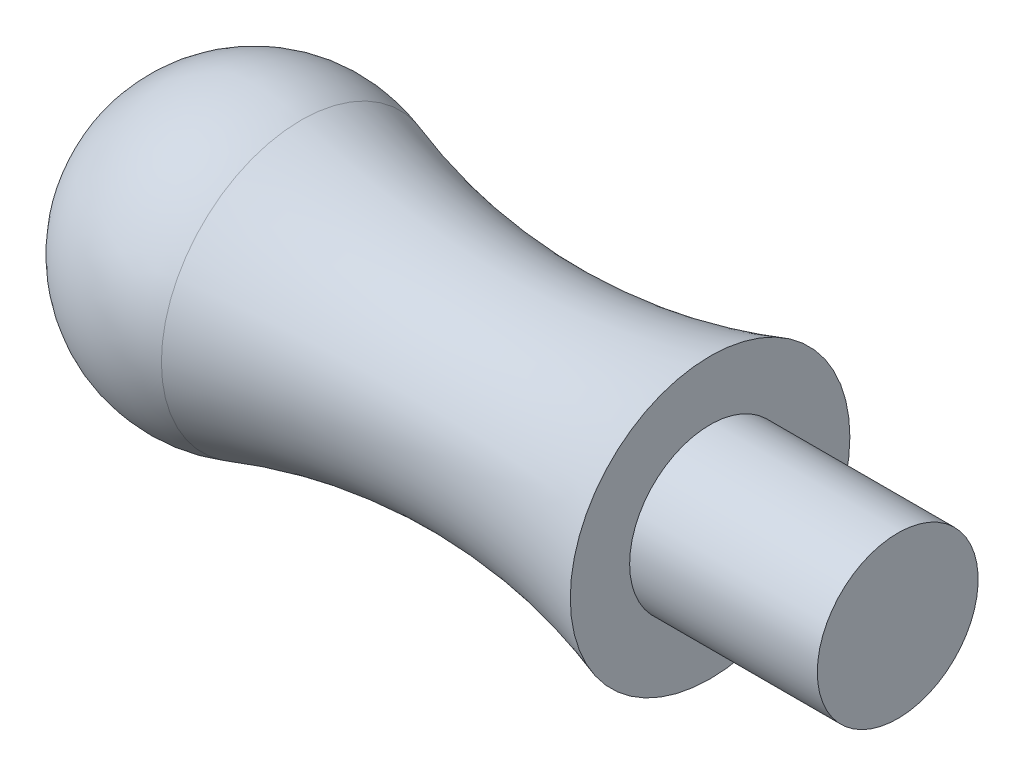
from build123d import *


with BuildPart() as part:
    # Sketch1 → Revolve2 (revolve)
    with BuildSketch(Plane.XY, mode=Mode.PRIVATE) as revolve2_sk:
        with BuildLine():
            Line((0, 0), (24, 0))
            Line((24, 0), (24, 3))
            Line((24, 3), (17, 3))
            Line((17, 3), (17, 5.21494699))
            ThreePointArc((17, 5.21494699), (9.373831776, 3.971079311), (1.747663551, 5.21494699))
            ThreePointArc((1.747663551, 5.21494699), (-3.212308396, 4.464423229), (-5.5, 0))
            Line((-5.5, 0), (0, 0))
        make_face()
    revolve(revolve2_sk.sketch.rotate(Axis((0, 0, 0), (1, 0, 0)), 90), axis=Axis((0, 0, 0), (1, 0, 0)))


solid = part.part
